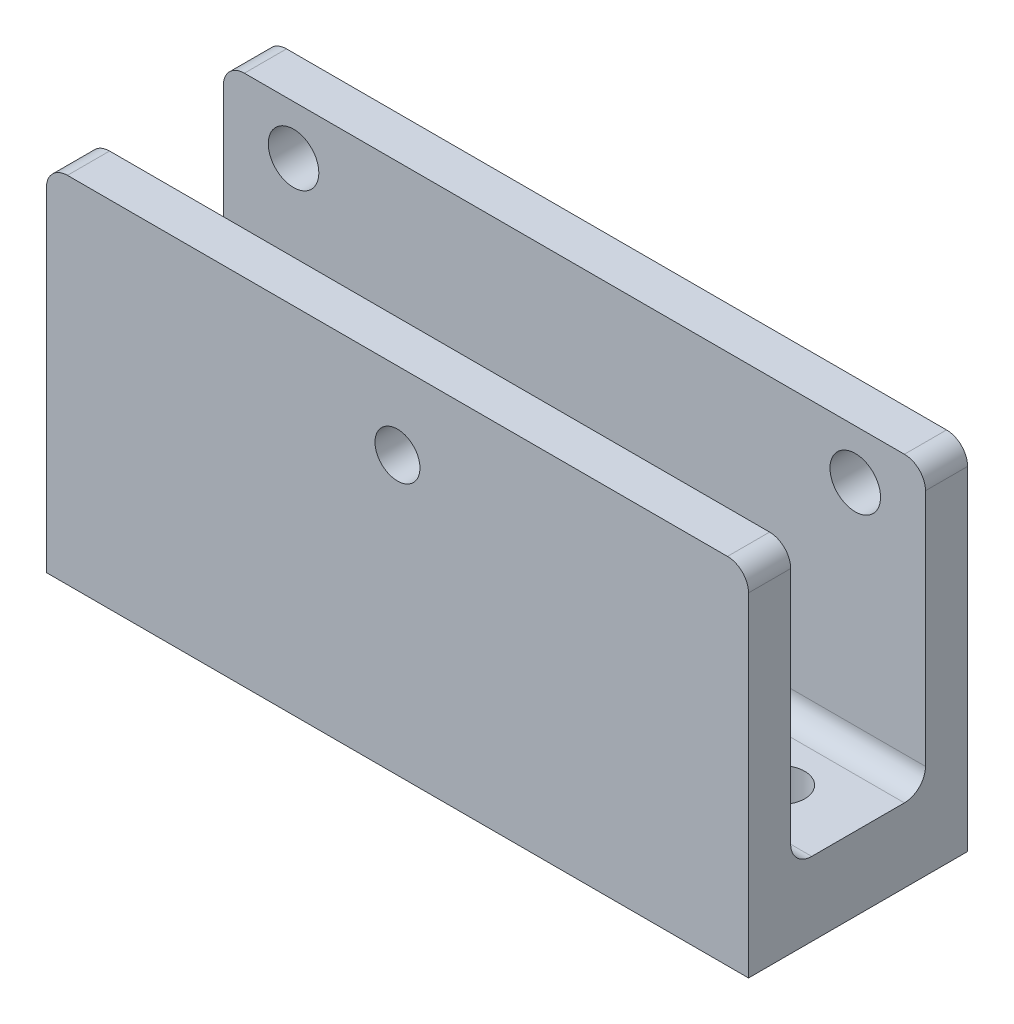
from build123d import *

# Parameters (mm, degrees)
SKETCH1_W                = 50
SKETCH1_H                = 9.6
BOSS_EXTRUDE1_DEPTH      = 5.25
SKETCH2_R                = 2.5
CUT_EXTRUDE1_DEPTH       = 2.1
M3_CLEARANCE_HOLE1_D     = 3.4
M3_CLEARANCE_HOLE1_DEPTH = 7.978536948
M3_CLEARANCE_HOLE1_TIP   = 1.021463052
SKETCH5_W                = 50
SKETCH5_H                = 25.25
BOSS_EXTRUDE2_DEPTH      = 3
FILLET1_R                = 1.5
M3_CLEARANCE_HOLE4_D     = 3.2
M3_CLEARANCE_HOLE4_DEPTH = 3.03862301
M3_CLEARANCE_HOLE4_TIP   = 0.96137699
M3_CLEARANCE_HOLE5_D     = 3.6
M3_CLEARANCE_HOLE5_DEPTH = 3.918450886
M3_CLEARANCE_HOLE5_TIP   = 1.081549114
FILLET2_R                = 1.5


with BuildPart() as part:
    # Sketch1 → Boss-Extrude1 (new body)
    with BuildSketch(Plane(origin=(0, 0, 0), x_dir=(1, 0, 0), z_dir=(0, 1, 0))):
        Rectangle(SKETCH1_W, SKETCH1_H)
    extrude(amount=BOSS_EXTRUDE1_DEPTH)

    # Sketch2 → Cut-Extrude1 (cut)
    with BuildSketch(Plane.XZ):
        with Locations(Location((-19.5, 0, 0), (0, 0, 270))):
            Circle(SKETCH2_R)
        with Locations(Location((-5.5, 0, 0), (0, 0, 270))):
            Circle(SKETCH2_R)
        with Locations(Location((5.5, 0, 0), (0, 0, 270))):
            Circle(SKETCH2_R)
        with Locations(Location((19.5, 0, 0), (0, 0, 270))):
            Circle(SKETCH2_R)
    extrude(amount=-CUT_EXTRUDE1_DEPTH, mode=Mode.SUBTRACT)

    # M3 Clearance Hole1
    with Locations(Plane(origin=(0, 5.25, 0), x_dir=(1, 0, 0), z_dir=(0, 1, 0))):
        with Locations((-19.5, 0), (-5.5, 0), (5.5, 0), (19.5, 0)):
            Hole(M3_CLEARANCE_HOLE1_D / 2, depth=M3_CLEARANCE_HOLE1_DEPTH)
            with Locations((0, 0, -(M3_CLEARANCE_HOLE1_DEPTH + M3_CLEARANCE_HOLE1_TIP / 2))):  # 118° drill point
                Cone(0, M3_CLEARANCE_HOLE1_D / 2, M3_CLEARANCE_HOLE1_TIP, mode=Mode.SUBTRACT)

    # Sketch5 → Boss-Extrude2 (add)
    with BuildSketch(Plane.XY.offset(4.8)):
        with Locations((0, 12.625)):
            Rectangle(SKETCH5_W, SKETCH5_H)
    boss_extrude2 = extrude(amount=BOSS_EXTRUDE2_DEPTH)

    # Mirror1: Boss-Extrude2 across plane
    add(boss_extrude2.mirror(Plane.XY))

    # Fillet1
    fillet1_edges = [part.edges().sort_by_distance(p)[0] for p in [
        (0, 5.25, 4.8),
        (0, 5.25, -4.8),
    ]]
    fillet(fillet1_edges, radius=FILLET1_R)

    # M3 Clearance Hole4
    with Locations(Plane.XY.offset(7.8)):
        with Locations((0, 19.75)):
            Hole(M3_CLEARANCE_HOLE4_D / 2, depth=M3_CLEARANCE_HOLE4_DEPTH)
            with Locations((0, 0, -(M3_CLEARANCE_HOLE4_DEPTH + M3_CLEARANCE_HOLE4_TIP / 2))):  # 118° drill point
                Cone(0, M3_CLEARANCE_HOLE4_D / 2, M3_CLEARANCE_HOLE4_TIP, mode=Mode.SUBTRACT)

    # M3 Clearance Hole5
    with Locations(Plane(origin=(0, 0, -7.8), x_dir=(-1, 0, 0), z_dir=(0, 0, -1))):
        with Locations((-20, 21.75), (20, 21.75), (12.75, 11.75), (-12.75, 11.75)):
            Hole(M3_CLEARANCE_HOLE5_D / 2, depth=M3_CLEARANCE_HOLE5_DEPTH)
            with Locations((0, 0, -(M3_CLEARANCE_HOLE5_DEPTH + M3_CLEARANCE_HOLE5_TIP / 2))):  # 118° drill point
                Cone(0, M3_CLEARANCE_HOLE5_D / 2, M3_CLEARANCE_HOLE5_TIP, mode=Mode.SUBTRACT)

    # Fillet2
    fillet2_edges = [part.edges().sort_by_distance(p)[0] for p in [
        (-25, 25.25, 6.3),
        (25, 25.25, 6.3),
        (-25, 25.25, -6.3),
        (25, 25.25, -6.3),
    ]]
    fillet(fillet2_edges, radius=FILLET2_R)


solid = part.part
